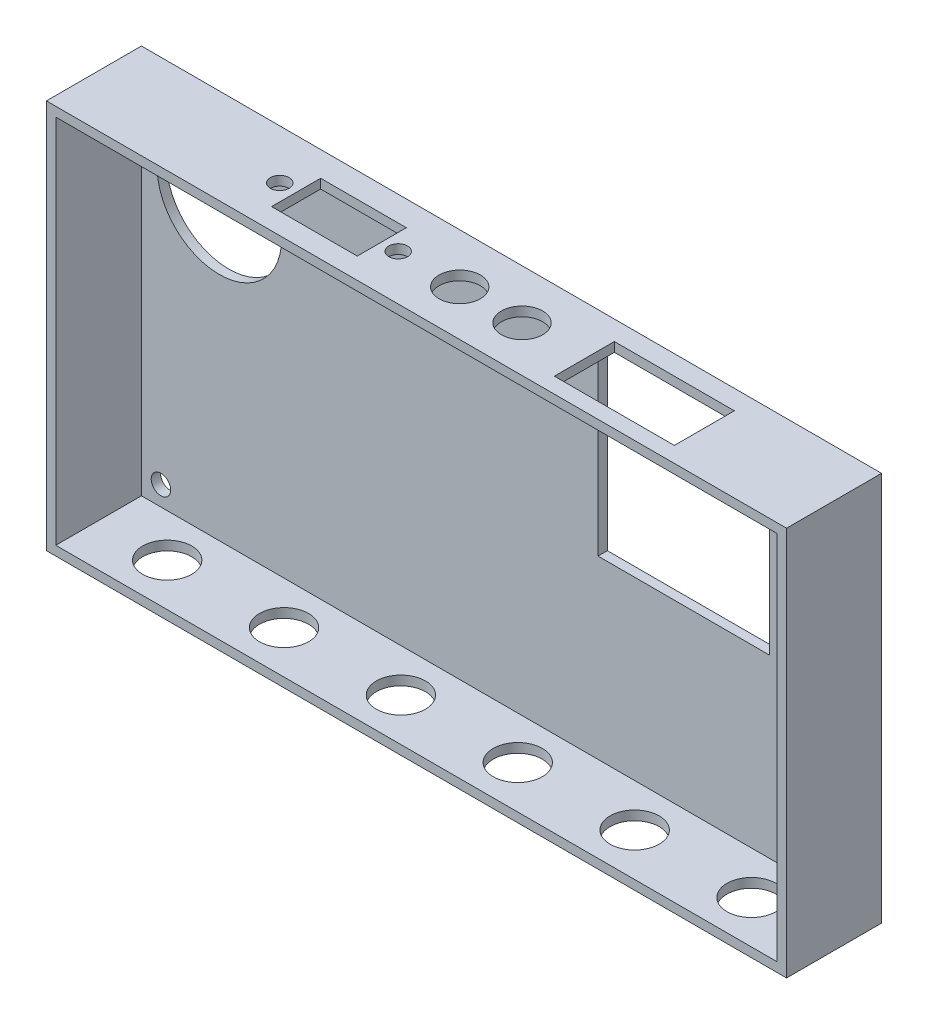
from build123d import *

# Parameters (mm, degrees)
SKICA2_W                 = 95
SKICA2_H                 = 50
SKICA2_W_2               = 92.6
SKICA2_H_2               = 47.6
P_IDAT_VYSUNUT_M3_DEPTH  = 11
SKICA7_R                 = 1.2
SKICA7_W                 = 11
SKICA7_H                 = 6.3
ODEBRAT_VYSUNUT_M1_DEPTH = 71.924466864
SKICA8_R                 = 2.65
SKICA8_W                 = 15.4
SKICA8_H                 = 7.7
ODEBRAT_VYSUNUT_M2_DEPTH = 71.924466864
SKICA9_R                 = 3.15
ODEBRAT_VYSUNUT_M3_DEPTH = 15
SKICA12_W                = 95
SKICA12_H                = 50
P_IDAT_VYSUNUT_M4_DEPTH  = 1.2
SKICA13_R                = 8
SKICA13_W                = 22
SKICA13_H                = 25
SKICA13_R_2              = 1.2
SKICA13_R_3              = 1.25
ODEBRAT_VYSUNUT_M4_DEPTH = 1.2


with BuildPart() as part:
    # Skica2 → Přidat vysunutím3 (new body)
    with BuildSketch(Plane.XY.offset(1.2)):
        with Locations((47.5, -25)):
            Rectangle(SKICA2_W, SKICA2_H)
        with Locations((47.5, -25)):
            Rectangle(SKICA2_W_2, SKICA2_H_2, mode=Mode.SUBTRACT)
    extrude(amount=P_IDAT_VYSUNUT_M3_DEPTH)

    # Skica7 → Odebrat vysunutím1 (cut, through all)
    with BuildSketch(Plane(origin=(45, -1.2, 0), x_dir=(1, 0, 0), z_dir=(0, -1, 0))):
        with Locations(Location((-20.9, 6.35, 0), (0, 0, 270))):
            Circle(SKICA7_R)
        with Locations(Location((-5.7, 6.35, 0), (0, 0, 270))):
            Circle(SKICA7_R)
        with Locations((-13.3, 6.35)):
            Rectangle(SKICA7_W, SKICA7_H)
    extrude(amount=-ODEBRAT_VYSUNUT_M1_DEPTH, mode=Mode.SUBTRACT)

    # Skica8 → Odebrat vysunutím2 (cut, through all)
    with BuildSketch(Plane(origin=(45, -1.2, 0), x_dir=(1, 0, 0), z_dir=(0, -1, 0))):
        with Locations(Location((2.2, 6.35, 0), (0, 0, 270))):
            Circle(SKICA8_R)
        with Locations(Location((10.2, 6.35, 0), (0, 0, 270))):
            Circle(SKICA8_R)
        with Locations((25.9, 6.35)):
            Rectangle(SKICA8_W, SKICA8_H)
    extrude(amount=-ODEBRAT_VYSUNUT_M2_DEPTH, mode=Mode.SUBTRACT)

    # Skica9 → Odebrat vysunutím3 (cut)
    with BuildSketch(Plane(origin=(45, -50, 0), x_dir=(1, 0, 0), z_dir=(0, -1, 0))):
        with Locations(Location((-20, 6.7, 0), (0, 0, 270))):
            Circle(SKICA9_R)
        with Locations(Location((-5, 6.7, 0), (0, 0, 270))):
            Circle(SKICA9_R)
        with Locations(Location((10, 6.7, 0), (0, 0, 270))):
            Circle(SKICA9_R)
        with Locations(Location((25, 6.7, 0), (0, 0, 270))):
            Circle(SKICA9_R)
        with Locations(Location((40, 6.7, 0), (0, 0, 270))):
            Circle(SKICA9_R)
        with Locations(Location((-35, 6.7, 0), (0, 0, 270))):
            Circle(SKICA9_R)
    extrude(amount=-ODEBRAT_VYSUNUT_M3_DEPTH, mode=Mode.SUBTRACT)

    # Skica12 → Přidat vysunutím4 (add)
    with BuildSketch(Plane(origin=(0, 0, 1.2), x_dir=(-1, 0, 0), z_dir=(0, 0, -1))):
        with Locations((-47.5, -25)):
            Rectangle(SKICA12_W, SKICA12_H)
    extrude(amount=P_IDAT_VYSUNUT_M4_DEPTH)

    # Skica13 → Odebrat vysunutím4 (cut)
    with BuildSketch(Plane.XY.offset(1.2)):
        with Locations((11.2, -11.2)):
            Circle(SKICA13_R)
        with Locations((70.8, -13.7)):
            Rectangle(SKICA13_W, SKICA13_H)
        with Locations((3.7, -3.7)):
            Circle(SKICA13_R_2)
        with Locations((91.3, -3.7)):
            Circle(SKICA13_R_3)
        with Locations((91.3, -46.3)):
            Circle(SKICA13_R_3)
        with Locations((3.7, -46.3)):
            Circle(SKICA13_R_3)
    extrude(amount=-ODEBRAT_VYSUNUT_M4_DEPTH, mode=Mode.SUBTRACT)


solid = part.part
